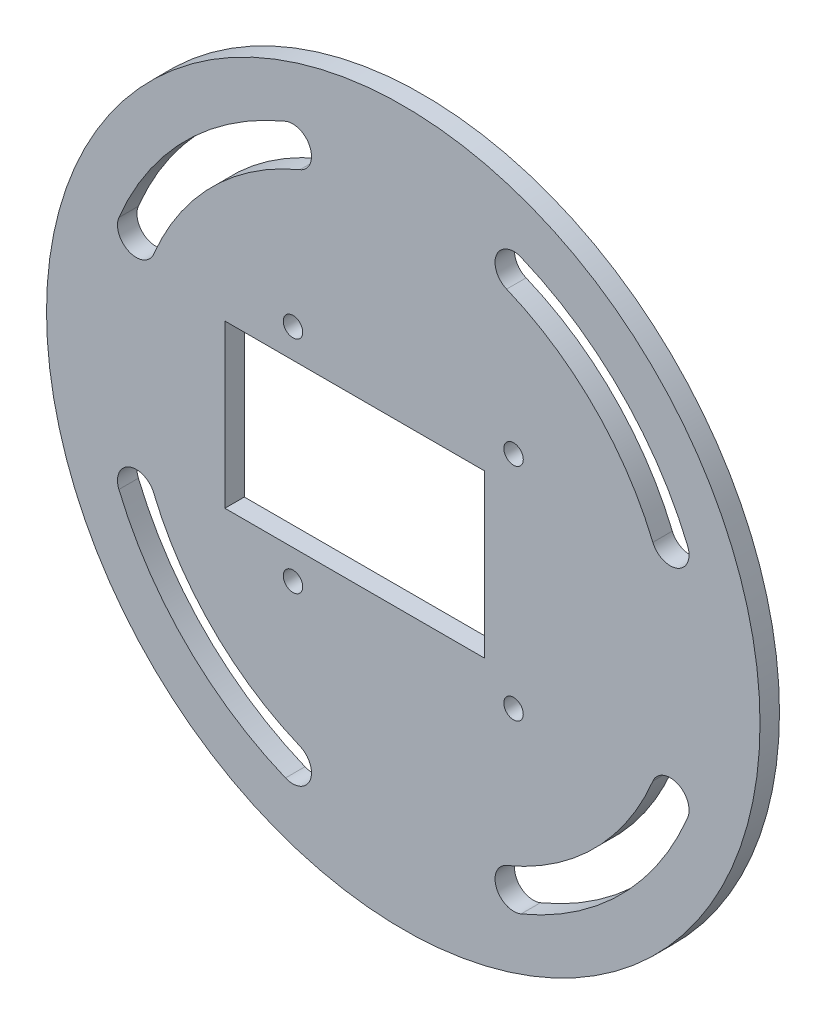
from build123d import *

# Parameters (mm, degrees)
SKETCH1_R           = 55
BOSS_EXTRUDE1_DEPTH = 3
CUT_EXTRUDE1_DEPTH  = 78.839578622
SKETCH4_R           = 1.5
CUT_EXTRUDE2_DEPTH  = 78.839578622


with BuildPart() as part:
    # Sketch1 → Boss-Extrude1 (new body)
    with BuildSketch(Plane.XY):
        Circle(SKETCH1_R)
    extrude(amount=BOSS_EXTRUDE1_DEPTH)

    # Sketch3 → Cut-Extrude1 (cut, through all)
    with BuildSketch(Plane.XY.offset(3)):
        with BuildLine():
            ThreePointArc((-15.937895201, 38.477482749), (-14.36842651, 42.266515347), (-18.157459108, 43.835984038))
            ThreePointArc((-18.157459108, 43.835984038), (-33.550609665, 33.550609665), (-43.835984038, 18.157459108))
            ThreePointArc((-43.835984038, 18.157459108), (-42.266515347, 14.36842651), (-38.477482749, 15.937895201))
            ThreePointArc((-38.477482749, 15.937895201), (-29.449390335, 29.449390335), (-15.937895201, 38.477482749))
        make_face()
        with BuildLine():
            ThreePointArc((18.157459108, 43.835984038), (14.36842651, 42.266515347), (15.937895201, 38.477482749))
            ThreePointArc((15.937895201, 38.477482749), (29.449390335, 29.449390335), (38.477482749, 15.937895201))
            ThreePointArc((38.477482749, 15.937895201), (42.266515347, 14.36842651), (43.835984038, 18.157459108))
            ThreePointArc((43.835984038, 18.157459108), (33.550609665, 33.550609665), (18.157459108, 43.835984038))
        make_face()
        with BuildLine():
            ThreePointArc((43.835984038, -18.157459108), (42.266515347, -14.36842651), (38.477482749, -15.937895201))
            ThreePointArc((38.477482749, -15.937895201), (29.449390335, -29.449390335), (15.937895201, -38.477482749))
            ThreePointArc((15.937895201, -38.477482749), (14.36842651, -42.266515347), (18.157459108, -43.835984038))
            ThreePointArc((18.157459108, -43.835984038), (33.550609665, -33.550609665), (43.835984038, -18.157459108))
        make_face()
        with BuildLine():
            ThreePointArc((-18.157459108, -43.835984038), (-14.36842651, -42.266515347), (-15.937895201, -38.477482749))
            ThreePointArc((-15.937895201, -38.477482749), (-29.449390335, -29.449390335), (-38.477482749, -15.937895201))
            ThreePointArc((-38.477482749, -15.937895201), (-42.266515347, -14.36842651), (-43.835984038, -18.157459108))
            ThreePointArc((-43.835984038, -18.157459108), (-33.550609665, -33.550609665), (-18.157459108, -43.835984038))
        make_face()
    extrude(amount=-CUT_EXTRUDE1_DEPTH, mode=Mode.SUBTRACT)

    # Sketch4 → Cut-Extrude2 (cut, through all)
    with BuildSketch(Plane.XY.offset(3)):
        with Locations((-17, 17)):
            Circle(SKETCH4_R)
        with Locations((17, 17)):
            Circle(SKETCH4_R)
        with Locations((17, -17)):
            Circle(SKETCH4_R)
        with Locations((-17, -17)):
            Circle(SKETCH4_R)
        Polygon((-12.5, 12.5), (-27.5, 12.5), (-27.5, -12.5), (-12.5, -12.5), (12.5, -12.5), (12.5, 12.5), align=None)
    extrude(amount=-CUT_EXTRUDE2_DEPTH, mode=Mode.SUBTRACT)


solid = part.part
